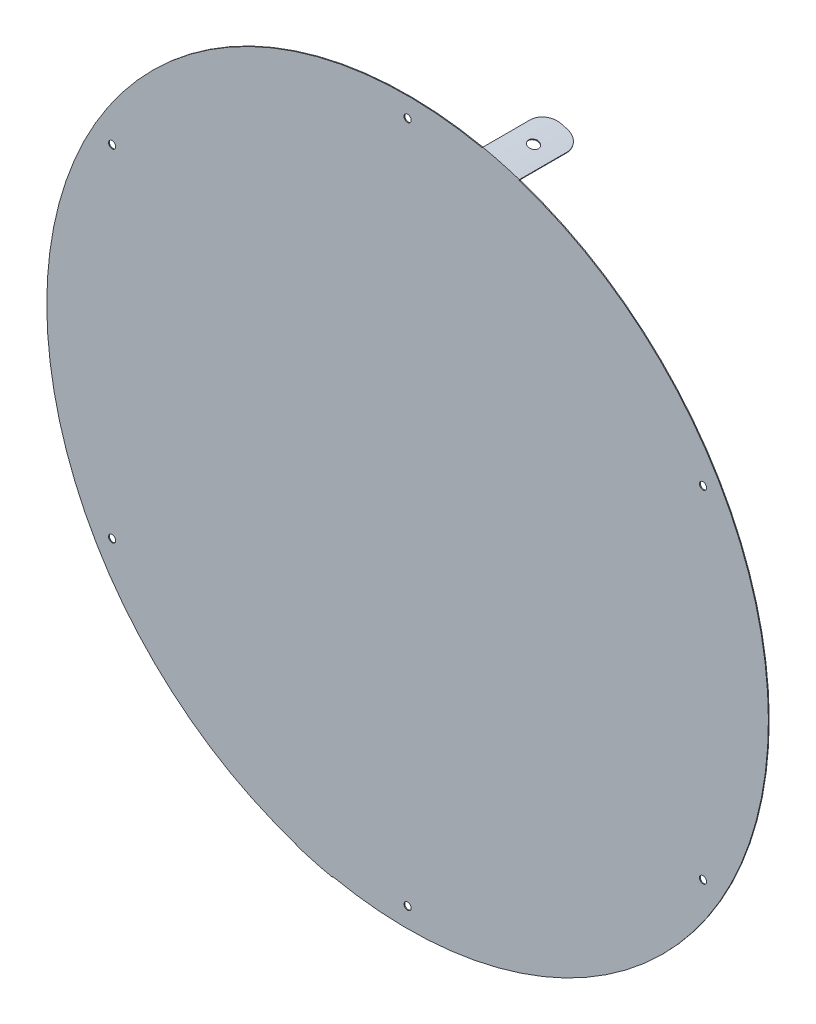
from build123d import *

# Parameters (mm, degrees)
SKETCH1_R           = 114.3
SKETCH1_R_2         = 1.1303
BOSS_EXTRUDE1_DEPTH = 0.254
BOSS_EXTRUDE2_START = -20
BOSS_EXTRUDE2_DEPTH = 20
SKETCH3_R           = 1.63195
CUT_EXTRUDE1_DEPTH  = 268.813456051
CIRPATTERN1_COUNT   = 2


with BuildPart() as part:
    # Sketch1 → Boss-Extrude1 (new body)
    with BuildSketch(Plane.XY):
        with Locations((-20.073709177, -8.103148659)):
            Circle(SKETCH1_R)
        with Locations((-20.073709177, -116.165648659)):
            Circle(SKETCH1_R_2, mode=Mode.SUBTRACT)
        with Locations((-113.658579374, -62.134398659)):
            Circle(SKETCH1_R_2, mode=Mode.SUBTRACT)
        with Locations((73.511161019, -62.134398659)):
            Circle(SKETCH1_R_2, mode=Mode.SUBTRACT)
        with Locations((-113.658579374, 45.928101341)):
            Circle(SKETCH1_R_2, mode=Mode.SUBTRACT)
        with Locations((73.511161019, 45.928101341)):
            Circle(SKETCH1_R_2, mode=Mode.SUBTRACT)
        with Locations((-20.073709177, 99.959351341)):
            Circle(SKETCH1_R_2, mode=Mode.SUBTRACT)
    extrude(amount=BOSS_EXTRUDE1_DEPTH)

    # Sketch2 → Boss-Extrude2 (add)
    with BuildSketch(Plane.XY.offset(0.254).offset(BOSS_EXTRUDE2_START)):
        with BuildLine():
            Line((3.743406653, 103.947571596), (3.690597083, 103.699122105))
            ThreePointArc((3.690597083, 103.699122105), (9.509307678, 102.302173286), (15.24693328, 100.602611154))
            Line((15.24693328, 100.602611154), (15.325423596, 100.844179509))
            ThreePointArc((15.325423596, 100.844179509), (9.575047716, 102.547518446), (3.743406653, 103.947571596))
        make_face()
    boss_extrude2 = extrude(amount=BOSS_EXTRUDE2_DEPTH)

    # Sketch3 → Cut-Extrude1 (cut, through all)
    with BuildSketch(Plane(origin=(9.575047716, 102.547518446, 0.254), x_dir=(-0.96592582628907, 0.25881904510251436, 0), z_dir=(0.25881904510251436, 0.96592582628907, 0))):
        with Locations((0, -10.254)):
            Circle(SKETCH3_R)
        with BuildLine():
            Line((-5.995293131, -20), (-0.995293131, -20))
            ThreePointArc((-0.995293131, -20), (-4.530827037, -18.535533906), (-5.995293131, -15))
            Line((-5.995293131, -15), (-5.995293131, -20))
        make_face()
        with BuildLine():
            ThreePointArc((5.995293131, -15), (4.530827037, -18.535533906), (0.995293131, -20))
            Line((0.995293131, -20), (5.995293131, -20))
            Line((5.995293131, -20), (5.995293131, -15))
        make_face()
    cut_extrude1 = extrude(amount=-CUT_EXTRUDE1_DEPTH, mode=Mode.SUBTRACT)

    # CirPattern1: Boss-Extrude2, Cut-Extrude1 ×2 about axis
    cirpattern1_axis = Axis((-20.073709177, -8.103148659, 0.254), (0, 0, -1))
    add([boss_extrude2.rotate(cirpattern1_axis, i * 360 / CIRPATTERN1_COUNT) for i in range(1, CIRPATTERN1_COUNT)])
    add([cut_extrude1.rotate(cirpattern1_axis, i * 360 / CIRPATTERN1_COUNT) for i in range(1, CIRPATTERN1_COUNT)], mode=Mode.SUBTRACT)


solid = part.part
